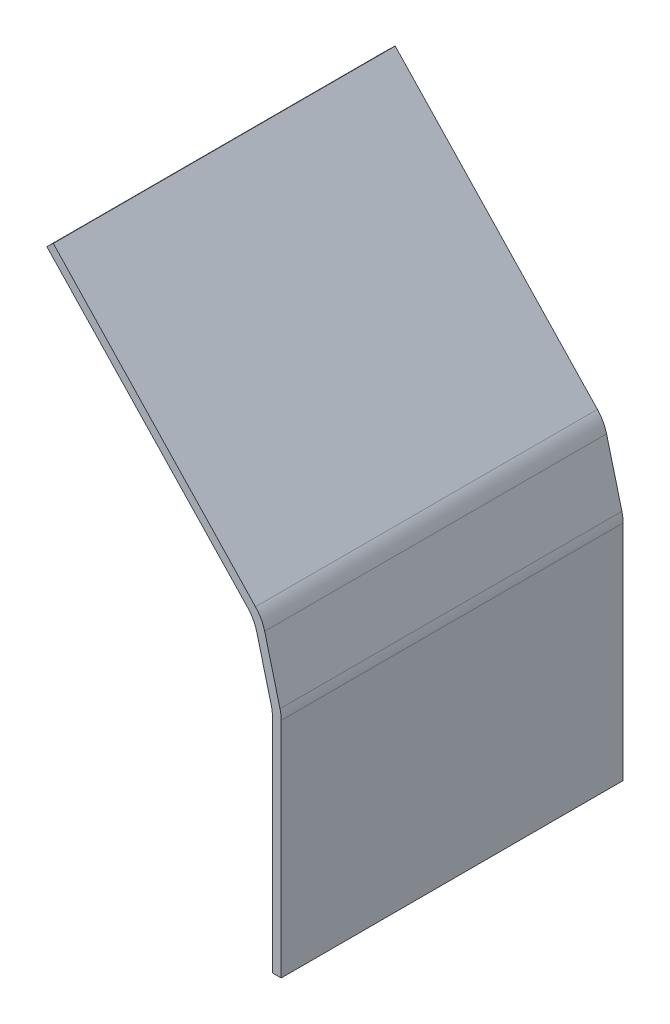
from build123d import *

# Parameters (mm, degrees)
BOSS_EXTRUDE1_DEPTH = 57.15
FILLET1_R           = 6.35
FILLET2_R           = 6.35


with BuildPart() as part:
    # Sketch2 → Boss-Extrude1 (new body)
    with BuildSketch(Plane.XY):
        Polygon((0, 0), (0, 38.1), (-3.175, 50.396722124), (-38.1, 87.286888497), (-39.169814825, 86.274063497), (-4.506325115, 49.660122124), (-1.4732, 37.912879066), (-1.4732, 0), align=None)
    extrude(amount=-BOSS_EXTRUDE1_DEPTH)

    # Fillet1
    fillet1_edges = [part.edges().sort_by_distance(p)[0] for p in [
        (-3.175, 50.396722124, -28.575),
        (0, 38.1, -28.575),
    ]]
    fillet(fillet1_edges, radius=FILLET1_R)

    # Fillet2
    fillet2_edges = [part.edges().sort_by_distance(p)[0] for p in [
        (-1.4732, 37.912879066, -28.575),
        (-4.506325115, 49.660122124, -28.575),
    ]]
    fillet(fillet2_edges, radius=FILLET2_R)


solid = part.part
